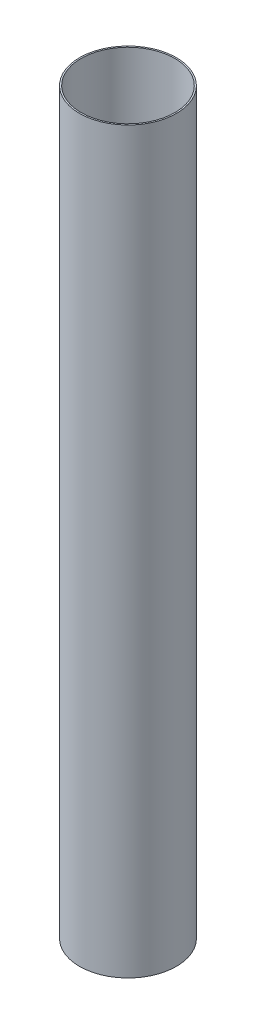
from build123d import *

# Parameters (mm, degrees)
ESBO_O2_R                = 19
ESBO_O2_R_2              = 18.42
RESSALTO_EXTRUS_O1_DEPTH = 290


with BuildPart() as part:
    # Esboço2 → Ressalto-extrusão1 (new body)
    with BuildSketch(Plane(origin=(0, 0, 0), x_dir=(1, 0, 0), z_dir=(0, 1, 0))):
        with Locations(Location((0, 0, 0), (0, 0, 270))):
            Circle(ESBO_O2_R)
        with Locations(Location((0, 0, 0), (0, 0, 270))):
            Circle(ESBO_O2_R_2, mode=Mode.SUBTRACT)
    extrude(amount=RESSALTO_EXTRUS_O1_DEPTH)


solid = part.part
